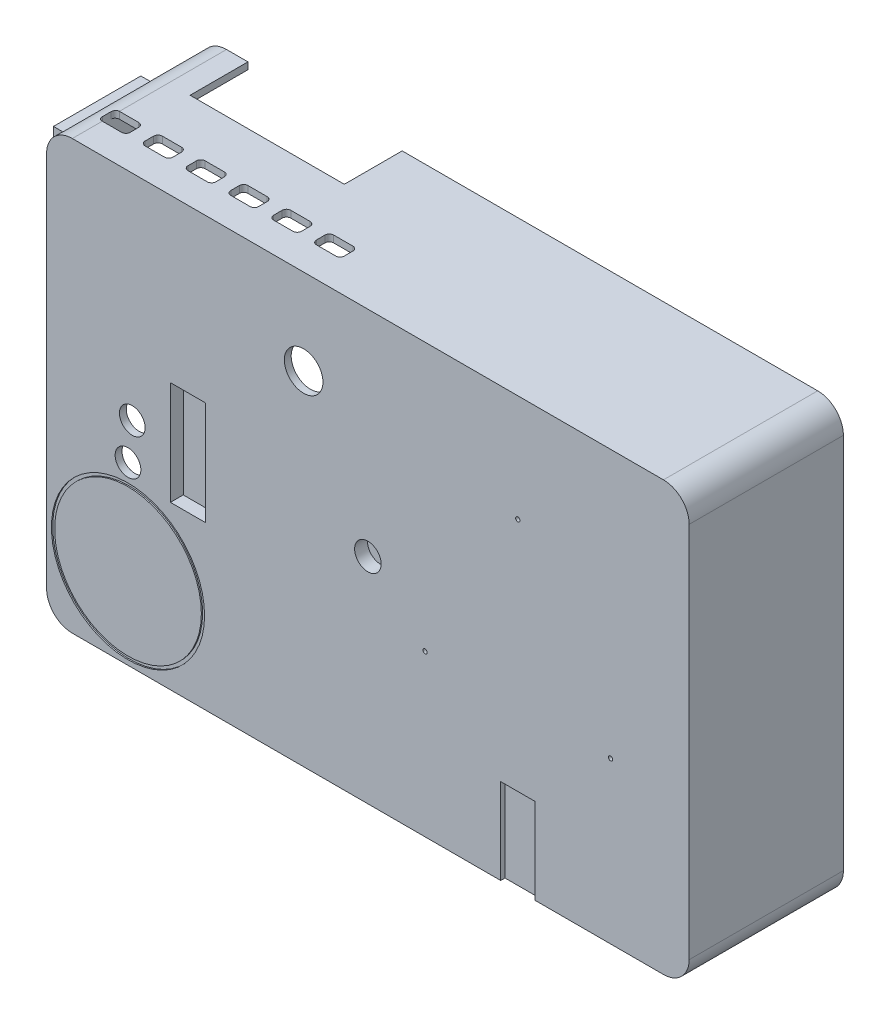
from build123d import *

# Parameters (mm, degrees)
PLINTH_BLOCK_DEPTH                  = 72
SKETCH2_W                           = 142
SKETCH2_H                           = 193.6
HOLLOW_BAY_AND_FRONT_VOID_DEPTH     = 34.65
SKETCH3_W                           = 152.6
SKETCH3_H                           = 2.4
DISH_SUPPORT_RIBS_DEPTH             = 68.8
SKETCH4_R                           = 64
DISH_FLOOR_THICKENING_DEPTH         = 4.8
SKETCH5_R                           = 12
ROD_SOCKET_BOSS_DEPTH               = 48.8
SKETCH6_W                           = 22
SKETCH6_H                           = 54
MORTISE_BLOCK_DEPTH                 = 8.8
SKETCH7_W                           = 10
SKETCH7_H                           = 13.3
END_PANEL_SCREW_BOSSES_DEPTH        = 40.8
SKETCH8_R                           = 6.2
ROD_SOCKET_DEPTH                    = 3.5
SKETCH9_W                           = 16.4
SKETCH9_H                           = 48.4
COLUMN_MORTISE_DEPTH                = 3.5
SKETCH10_R                          = 1
SEAT_PIN_HOLES_DEPTH                = 2.5
SKETCH11_W                          = 16
SKETCH11_H                          = 41
SPILL_DRAIN_CHANNEL_DEPTH           = 1.5
SKETCH12_R                          = 35.75
SKETCH12_R_2                        = 34.25
BOTTLE_POSITION_MARKER_GROOVE_DEPTH = 0.8
CABLE_GROMMET_HOLES_DEPTH           = 195.123671921
CABLE_GROMMET_HOLES_DEPTH_BACK      = 195.123671921
SKETCH13_R                          = 9
SKETCH13_R_2                        = 6
SKETCH14_W                          = 72
SKETCH14_H                          = 28
PI_SIDE_PORT_NOTCH_AND_VENTS_DEPTH  = 2.6
SKETCH15_R                          = 1.3
END_PANEL_SCREW_HOLES_DEPTH         = 6.5


with BuildPart() as part:
    # Sketch1 → Plinth_block (new body)
    with BuildSketch(Plane.XY):
        with BuildLine():
            Line((-138, -100), (138, -100))
            ThreePointArc((138, -100), (146.485281374, -96.485281374), (150, -88))
            Line((150, -88), (150, 88))
            ThreePointArc((150, 88), (146.485281374, 96.485281374), (138, 100))
            Line((138, 100), (-138, 100))
            ThreePointArc((-138, 100), (-146.485281374, 96.485281374), (-150, 88))
            Line((-150, 88), (-150, -88))
            ThreePointArc((-150, -88), (-146.485281374, -96.485281374), (-138, -100))
        make_face()
    extrude(amount=PLINTH_BLOCK_DEPTH)

    # Sketch2 → Hollow_bay_and_front_void (cut, symmetric)
    with BuildSketch(Plane.XY.offset(34.15)):
        with Locations((-80, 0)):
            Rectangle(SKETCH2_W, SKETCH2_H)
        with BuildLine():
            Line((3.2, -96.8), (137.8, -96.8))
            ThreePointArc((137.8, -96.8), (144.163961031, -94.163961031), (146.8, -87.8))
            Line((146.8, -87.8), (146.8, 87.8))
            ThreePointArc((146.8, 87.8), (144.163961031, 94.163961031), (137.8, 96.8))
            Line((137.8, 96.8), (3.2, 96.8))
            ThreePointArc((3.2, 96.8), (-3.163961031, 94.163961031), (-5.8, 87.8))
            Line((-5.8, 87.8), (-5.8, -87.8))
            ThreePointArc((-5.8, -87.8), (-3.163961031, -94.163961031), (3.2, -96.8))
        make_face()
    extrude(amount=HOLLOW_BAY_AND_FRONT_VOID_DEPTH, both=True, mode=Mode.SUBTRACT)

    # Sketch3 → Dish_support_ribs (add)
    with BuildSketch(Plane.XY):
        with Locations((70.5, 40)):
            Rectangle(SKETCH3_W, SKETCH3_H)
        with Locations((70.5, -40)):
            Rectangle(SKETCH3_W, SKETCH3_H)
    extrude(amount=DISH_SUPPORT_RIBS_DEPTH)

    # Sketch4 → Dish_floor_thickening (add)
    with BuildSketch(Plane.XY.offset(64)):
        with Locations((70, 0)):
            Circle(SKETCH4_R)
    extrude(amount=DISH_FLOOR_THICKENING_DEPTH)

    # Sketch5 → Rod_socket_boss (add)
    with BuildSketch(Plane.XY.offset(20)):
        Circle(SKETCH5_R)
    extrude(amount=ROD_SOCKET_BOSS_DEPTH)

    # Sketch6 → Mortise_block (add)
    with BuildSketch(Plane.XY.offset(60)):
        with Locations((-84, 0)):
            Rectangle(SKETCH6_W, SKETCH6_H)
    extrude(amount=MORTISE_BLOCK_DEPTH)

    # Sketch7 → End_panel_screw_bosses (add)
    with BuildSketch(Plane.XY.offset(28)):
        with Locations((-145, 90.65)):
            Rectangle(SKETCH7_W, SKETCH7_H)
        with Locations((-145, -90.65)):
            Rectangle(SKETCH7_W, SKETCH7_H)
    extrude(amount=END_PANEL_SCREW_BOSSES_DEPTH)

    # Sketch8 → Rod_socket (cut, symmetric)
    with BuildSketch(Plane.XY.offset(69.5)):
        Circle(SKETCH8_R)
    extrude(amount=ROD_SOCKET_DEPTH, both=True, mode=Mode.SUBTRACT)

    # Sketch9 → Column_mortise (cut, symmetric)
    with BuildSketch(Plane.XY.offset(69.5)):
        with Locations((-84, 0)):
            Rectangle(SKETCH9_W, SKETCH9_H)
    extrude(amount=COLUMN_MORTISE_DEPTH, both=True, mode=Mode.SUBTRACT)

    # Sketch10 → Seat_pin_holes (cut, symmetric)
    with BuildSketch(Plane.XY.offset(70.5)):
        with Locations((70, 50)):
            Circle(SKETCH10_R)
        with Locations((26.698729811, -25)):
            Circle(SKETCH10_R)
        with Locations((113.301270189, -25)):
            Circle(SKETCH10_R)
    extrude(amount=SEAT_PIN_HOLES_DEPTH, both=True, mode=Mode.SUBTRACT)

    # Sketch11 → Spill_drain_channel (cut, symmetric)
    with BuildSketch(Plane.XY.offset(71.5)):
        with Locations((70, -80.5)):
            Rectangle(SKETCH11_W, SKETCH11_H)
    extrude(amount=SPILL_DRAIN_CHANNEL_DEPTH, both=True, mode=Mode.SUBTRACT)

    # Sketch12 → Bottle_position_marker_groove (cut, symmetric)
    with BuildSketch(Plane.XY.offset(72.2)):
        with Locations((-112, -62)):
            Circle(SKETCH12_R)
        with Locations((-112, -62)):
            Circle(SKETCH12_R_2, mode=Mode.SUBTRACT)
    extrude(amount=BOTTLE_POSITION_MARKER_GROOVE_DEPTH, both=True, mode=Mode.SUBTRACT)

    # Sketch13 → Cable_grommet_holes (cut, two sides: drawn at the far end of the back side and taken through both)
    with BuildSketch(Plane.XY.offset(-CABLE_GROMMET_HOLES_DEPTH_BACK)):
        with Locations((-30, 60)):
            Circle(SKETCH13_R)
        with Locations((-110, 0)):
            Circle(SKETCH13_R_2)
        with Locations((-112, -18)):
            Circle(SKETCH13_R_2)
    extrude(amount=CABLE_GROMMET_HOLES_DEPTH + CABLE_GROMMET_HOLES_DEPTH_BACK, mode=Mode.SUBTRACT)

    # Sketch14 → Pi_side_port_notch_and_vents (cut, symmetric)
    with BuildSketch(Plane(origin=(0, 98.4, 0), x_dir=(1, 0, 0), z_dir=(0, 1, 0))):
        with Locations((-92, -13)):
            Rectangle(SKETCH14_W, SKETCH14_H)
        with BuildLine():
            Line((-138, -50), (-129, -50))
            ThreePointArc((-129, -50), (-127.585786438, -50.585786438), (-127, -52))
            Line((-127, -52), (-127, -56))
            ThreePointArc((-127, -56), (-127.585786438, -57.414213562), (-129, -58))
            Line((-129, -58), (-138, -58))
            ThreePointArc((-138, -58), (-139.414213562, -57.414213562), (-140, -56))
            Line((-140, -56), (-140, -52))
            ThreePointArc((-140, -52), (-139.414213562, -50.585786438), (-138, -50))
        make_face()
        with BuildLine():
            Line((-118, -50), (-109, -50))
            ThreePointArc((-109, -50), (-107.585786438, -50.585786438), (-107, -52))
            Line((-107, -52), (-107, -56))
            ThreePointArc((-107, -56), (-107.585786438, -57.414213562), (-109, -58))
            Line((-109, -58), (-118, -58))
            ThreePointArc((-118, -58), (-119.414213562, -57.414213562), (-120, -56))
            Line((-120, -56), (-120, -52))
            ThreePointArc((-120, -52), (-119.414213562, -50.585786438), (-118, -50))
        make_face()
        with BuildLine():
            Line((-98, -50), (-89, -50))
            ThreePointArc((-89, -50), (-87.585786438, -50.585786438), (-87, -52))
            Line((-87, -52), (-87, -56))
            ThreePointArc((-87, -56), (-87.585786438, -57.414213562), (-89, -58))
            Line((-89, -58), (-98, -58))
            ThreePointArc((-98, -58), (-99.414213562, -57.414213562), (-100, -56))
            Line((-100, -56), (-100, -52))
            ThreePointArc((-100, -52), (-99.414213562, -50.585786438), (-98, -50))
        make_face()
        with BuildLine():
            Line((-78, -50), (-69, -50))
            ThreePointArc((-69, -50), (-67.585786438, -50.585786438), (-67, -52))
            Line((-67, -52), (-67, -56))
            ThreePointArc((-67, -56), (-67.585786438, -57.414213562), (-69, -58))
            Line((-69, -58), (-78, -58))
            ThreePointArc((-78, -58), (-79.414213562, -57.414213562), (-80, -56))
            Line((-80, -56), (-80, -52))
            ThreePointArc((-80, -52), (-79.414213562, -50.585786438), (-78, -50))
        make_face()
        with BuildLine():
            Line((-58, -50), (-49, -50))
            ThreePointArc((-49, -50), (-47.585786438, -50.585786438), (-47, -52))
            Line((-47, -52), (-47, -56))
            ThreePointArc((-47, -56), (-47.585786438, -57.414213562), (-49, -58))
            Line((-49, -58), (-58, -58))
            ThreePointArc((-58, -58), (-59.414213562, -57.414213562), (-60, -56))
            Line((-60, -56), (-60, -52))
            ThreePointArc((-60, -52), (-59.414213562, -50.585786438), (-58, -50))
        make_face()
        with BuildLine():
            Line((-38, -50), (-29, -50))
            ThreePointArc((-29, -50), (-27.585786438, -50.585786438), (-27, -52))
            Line((-27, -52), (-27, -56))
            ThreePointArc((-27, -56), (-27.585786438, -57.414213562), (-29, -58))
            Line((-29, -58), (-38, -58))
            ThreePointArc((-38, -58), (-39.414213562, -57.414213562), (-40, -56))
            Line((-40, -56), (-40, -52))
            ThreePointArc((-40, -52), (-39.414213562, -50.585786438), (-38, -50))
        make_face()
    extrude(amount=PI_SIDE_PORT_NOTCH_AND_VENTS_DEPTH, both=True, mode=Mode.SUBTRACT)

    # Sketch15 → End_panel_screw_holes (cut, symmetric)
    with BuildSketch(Plane(origin=(-144.5, 0, 0), x_dir=(0, 0, -1), z_dir=(1, 0, 0))):
        with Locations((-35, 90)):
            Circle(SKETCH15_R)
        with Locations((-35, -90)):
            Circle(SKETCH15_R)
    extrude(amount=END_PANEL_SCREW_HOLES_DEPTH, both=True, mode=Mode.SUBTRACT)


solid = part.part
